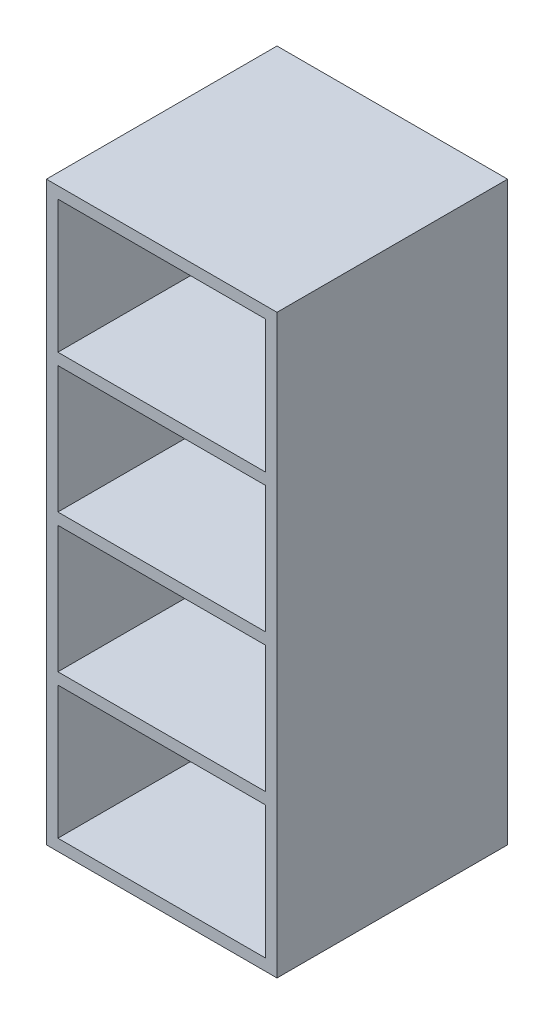
from build123d import *

# Parameters (mm, degrees)
SKETCH1_W           = 400
SKETCH1_H           = 1000
SKETCH1_W_2         = 360
SKETCH1_H_2         = 960
SKETCH1_H_3         = 20
BOSS_EXTRUDE1_DEPTH = 400
SKETCH2_W           = 400
SKETCH2_H           = 1000
BOSS_EXTRUDE2_DEPTH = 10


with BuildPart() as part:
    # Sketch1 → Boss-Extrude1 (new body)
    # profile 1 of 4: a face of its own
    with BuildSketch(Plane.XY):
        with Locations((0, 500)):
            Rectangle(SKETCH1_W, SKETCH1_H)
        with Locations((0, 500)):
            Rectangle(SKETCH1_W_2, SKETCH1_H_2, mode=Mode.SUBTRACT)
    # profile 2 of 4: a face of its own
    with BuildSketch(Plane.XY):
        with Locations((0, 740)):
            Rectangle(SKETCH1_W_2, SKETCH1_H_3)
    # profile 3 of 4: a face of its own
    with BuildSketch(Plane.XY):
        with Locations((0, 500)):
            Rectangle(SKETCH1_W_2, SKETCH1_H_3)
    # profile 4 of 4: a face of its own
    with BuildSketch(Plane.XY):
        with Locations((0, 260)):
            Rectangle(SKETCH1_W_2, SKETCH1_H_3)
    extrude(amount=BOSS_EXTRUDE1_DEPTH)

    # Sketch2 → Boss-Extrude2 (add)
    with BuildSketch(Plane(origin=(0, 0, 0), x_dir=(-1, 0, 0), z_dir=(0, 0, -1))):
        with Locations((0, 500)):
            Rectangle(SKETCH2_W, SKETCH2_H)
    extrude(amount=-BOSS_EXTRUDE2_DEPTH)


solid = part.part
